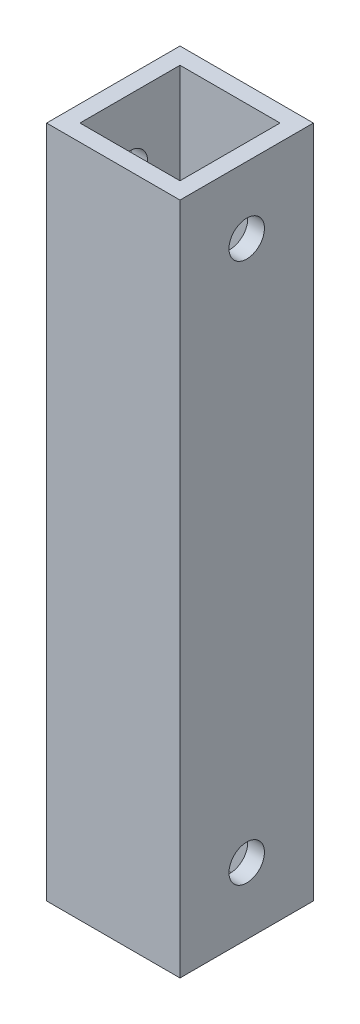
from build123d import *

# Parameters (mm, degrees)
SKETCH1_W           = 25.4
SKETCH1_H           = 25.4
SKETCH1_W_2         = 19.05
SKETCH1_H_2         = 19.05
BOSS_EXTRUDE1_DEPTH = 128.27
SKETCH2_W           = 46.765463489
SKETCH2_H           = 12.7
CUT_EXTRUDE1_DEPTH  = 12.7
SKETCH4_R           = 3.3734375
CUT_EXTRUDE2_DEPTH  = 132.37596013


with BuildPart() as part:
    # Sketch1 → Boss-Extrude1 (new body)
    with BuildSketch(Plane(origin=(0, 0, 0), x_dir=(1, 0, 0), z_dir=(0, 1, 0))):
        Rectangle(SKETCH1_W, SKETCH1_H)
        Rectangle(SKETCH1_W_2, SKETCH1_H_2, mode=Mode.SUBTRACT)
    extrude(amount=BOSS_EXTRUDE1_DEPTH)

    # Sketch2 → Cut-Extrude1 (cut)
    with BuildSketch(Plane(origin=(0, 0, -12.7), x_dir=(-1, 0, 0), z_dir=(0, 0, -1))):
        with Locations((18.302731745, 44.45)):
            Rectangle(SKETCH2_W, SKETCH2_H)
    extrude(amount=-CUT_EXTRUDE1_DEPTH, mode=Mode.SUBTRACT)

    # Sketch4 → Cut-Extrude2 (cut, through all)
    with BuildSketch(Plane(origin=(12.7, 0, 0), x_dir=(0, 0, -1), z_dir=(1, 0, 0))):
        with Locations((0, 115.57)):
            Circle(SKETCH4_R)
        with Locations((0, 12.7)):
            Circle(SKETCH4_R)
    extrude(amount=-CUT_EXTRUDE2_DEPTH, mode=Mode.SUBTRACT)


solid = part.part
